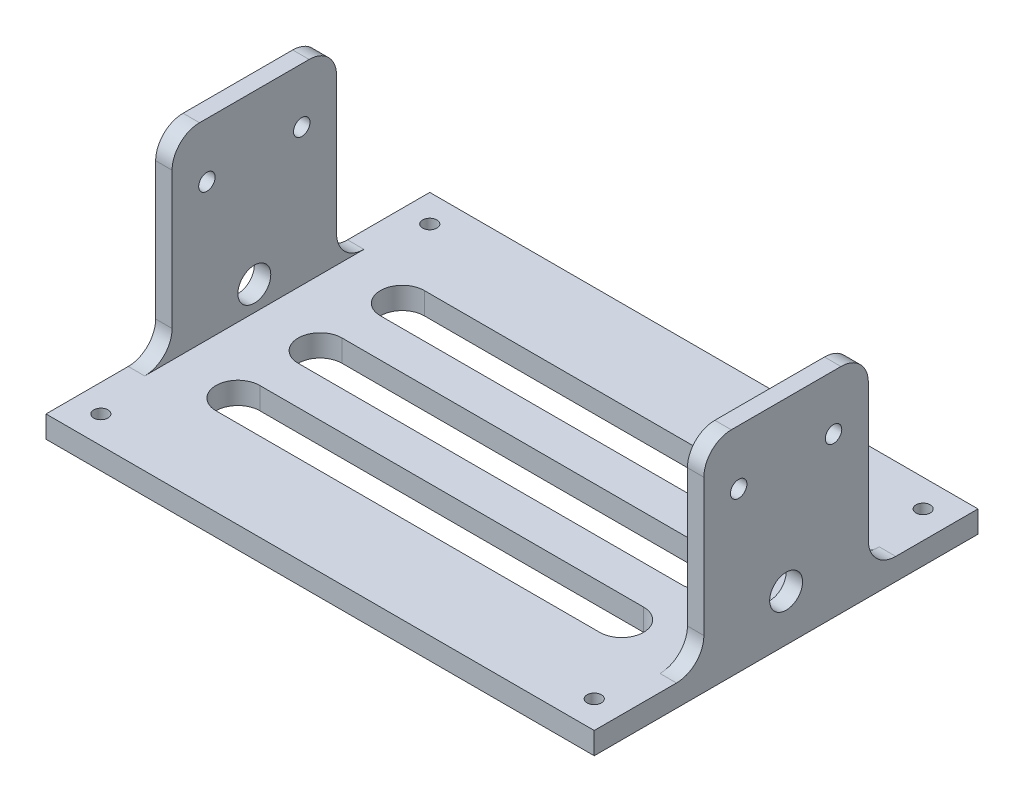
from build123d import *

# Parameters (mm, degrees)
SKETCH1_R            = 1.3
BOSS_EXTRUDE10_DEPTH = 4
SKETCH1_22_W         = 3
SKETCH1_22_H         = 30
BOSS_EXTRUDE11_DEPTH = 39
FILLET4_R            = 5
SKETCH4_R            = 1.5
SKETCH4_R_2          = 3
CUT_EXTRUDE19_DEPTH  = 126.8173279


with BuildPart() as part:
    # Sketch1 → Boss-Extrude10 (new body)
    with BuildSketch(Plane(origin=(0, 0, 0), x_dir=(1, 0, 0), z_dir=(0, 1, 0))):
        Polygon((0, 70), (0, 50), (3, 50), (3, 20), (0, 20), (0, 0), (100, 0), (100, 70), align=None)
        with Locations((5, 5)):
            Circle(SKETCH1_R, mode=Mode.SUBTRACT)
        with Locations((95, 5)):
            Circle(SKETCH1_R, mode=Mode.SUBTRACT)
        with BuildLine():
            ThreePointArc((15, 16), (11, 20), (15, 24))
            Line((15, 24), (85, 24))
            ThreePointArc((85, 24), (89, 20), (85, 16))
            Line((85, 16), (15, 16))
        make_face(mode=Mode.SUBTRACT)
        with Locations((5, 65)):
            Circle(SKETCH1_R, mode=Mode.SUBTRACT)
        with BuildLine():
            ThreePointArc((15, 31), (11, 35), (15, 39))
            Line((15, 39), (85, 39))
            ThreePointArc((85, 39), (89, 35), (85, 31))
            Line((85, 31), (15, 31))
        make_face(mode=Mode.SUBTRACT)
        with BuildLine():
            ThreePointArc((15, 46), (11, 50), (15, 54))
            Line((15, 54), (85, 54))
            ThreePointArc((85, 54), (89, 50), (85, 46))
            Line((85, 46), (15, 46))
        make_face(mode=Mode.SUBTRACT)
        with Locations((95, 65)):
            Circle(SKETCH1_R, mode=Mode.SUBTRACT)
    extrude(amount=BOSS_EXTRUDE10_DEPTH)

    # Sketch1<22> → Boss-Extrude11 (add)
    with BuildSketch(Plane(origin=(0, 0, 0), x_dir=(1, 0, 0), z_dir=(0, 1, 0))):
        with Locations((1.5, 35)):
            Rectangle(SKETCH1_22_W, SKETCH1_22_H)
    extrude(amount=BOSS_EXTRUDE11_DEPTH)

    # Fillet4
    fillet4_edges = [part.edges().sort_by_distance(p)[0] for p in [
        (1.5, 4, -50),
        (1.5, 39, -50),
        (1.5, 4, -20),
        (1.5, 39, -20),
    ]]
    fillet(fillet4_edges, radius=FILLET4_R)

    # Sketch4 → Cut-Extrude19 (cut, through all)
    with BuildSketch(Plane(origin=(3, 0, 0), x_dir=(0, 0, -1), z_dir=(1, 0, 0))):
        with Locations((26.35, 29)):
            Circle(SKETCH4_R)
        with Locations((43.65, 29)):
            Circle(SKETCH4_R)
        with Locations((35, 8.5)):
            Circle(SKETCH4_R_2)
    extrude(amount=-CUT_EXTRUDE19_DEPTH, mode=Mode.SUBTRACT)

    # Mirror7: part across plane


with BuildPart() as part_1:
    add(part.part)
    add(part.part.mirror(Plane(origin=(50, 0, 0), x_dir=(0, 0, 1), z_dir=(1, 0, 0))))


solid = part_1.part
